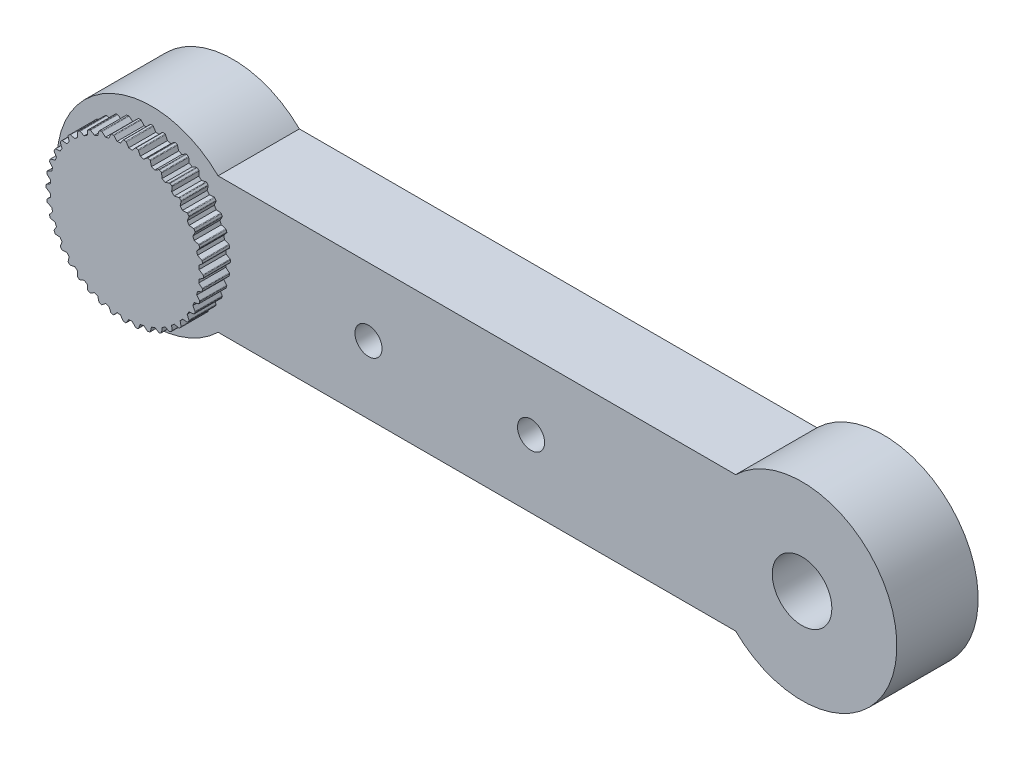
from build123d import *

# Parameters (mm, degrees)
BOSS_EXTRUDE2_DEPTH = 5
BOSS_EXTRUDE3_DEPTH = 15
SKETCH4_R           = 2.5
CUT_EXTRUDE1_DEPTH  = 15
SKETCH5_R           = 5.5
CUT_EXTRUDE2_DEPTH  = 15


with BuildPart() as part:
    # Sketch1 → Boss-Extrude2 (new body)
    with BuildSketch(Plane.XY):
        with BuildLine():
            ThreePointArc((0.302131887, 14.439333637), (0.247751873, 14.490367845), (0.175516255, 14.508906766))
            Line((0.175516255, 14.508906766), (-0.175516255, 14.508906766))
            ThreePointArc((-0.175516255, 14.508906766), (-0.247751873, 14.490367845), (-0.302131887, 14.439333637))
            Line((-0.302131887, 14.439333637), (-0.74, 13.75))
            Line((-0.74, 13.75), (-0.753110668, 13.729359939))
            ThreePointArc((-0.753110668, 13.729359939), (-1.078812566, 13.707613339), (-1.403906451, 13.6781412))
            Line((-1.403906451, 13.6781412), (-1.420084522, 13.696476187))
            Line((-1.420084522, 13.696476187), (-1.960397291, 14.30882532))
            ThreePointArc((-1.960397291, 14.30882532), (-2.022091305, 14.350724303), (-2.09633771, 14.357734839))
            Line((-2.09633771, 14.357734839), (-2.443048426, 14.302821256))
            ThreePointArc((-2.443048426, 14.302821256), (-2.511494579, 14.27321044), (-2.557221575, 14.21429764))
            Line((-2.557221575, 14.21429764), (-2.881863266, 13.464953179))
            Line((-2.881863266, 13.464953179), (-2.891583704, 13.442516271))
            ThreePointArc((-2.891583704, 13.442516271), (-3.209873753, 13.370086405), (-3.526354734, 13.290121229))
            Line((-3.526354734, 13.290121229), (-3.545201851, 13.305699675))
            Line((-3.545201851, 13.305699675), (-4.174654982, 13.825986234))
            ThreePointArc((-4.174654982, 13.825986234), (-4.242143885, 13.857718302), (-4.316572883, 13.853027829))
            Line((-4.316572883, 13.853027829), (-4.650424638, 13.744552818))
            ThreePointArc((-4.650424638, 13.744552818), (-4.713395953, 13.704599223), (-4.749343981, 13.639258459))
            Line((-4.749343981, 13.639258459), (-4.952765495, 12.848354523))
            Line((-4.952765495, 12.848354523), (-4.958856352, 12.824673239))
            ThreePointArc((-4.958856352, 12.824673239), (-5.261897195, 12.703343572), (-5.561972461, 12.574854367))
            Line((-5.561972461, 12.574854367), (-5.583024544, 12.587292677))
            Line((-5.583024544, 12.587292677), (-6.286118812, 13.002705482))
            ThreePointArc((-6.286118812, 13.002705482), (-6.357740804, 13.023489285), (-6.430519705, 13.007213299))
            Line((-6.430519705, 13.007213299), (-6.743291961, 12.847847875))
            ThreePointArc((-6.743291961, 12.847847875), (-6.799237875, 12.798535291), (-6.824521776, 12.72837547))
            Line((-6.824521776, 12.72837547), (-6.901714199, 11.915386738))
            Line((-6.901714199, 11.915386738), (-6.904025499, 11.891044189))
            ThreePointArc((-6.904025499, 11.891044189), (-7.184355265, 11.72380226), (-7.460635966, 11.549952856))
            Line((-7.460635966, 11.549952856), (-7.483374643, 11.558944759))
            Line((-7.483374643, 11.558944759), (-8.242797534, 11.859254967))
            ThreePointArc((-8.242797534, 11.859254967), (-8.316789044, 11.868578739), (-8.386125791, 11.841118009))
            Line((-8.386125791, 11.841118009), (-8.670117057, 11.634786277))
            ThreePointArc((-8.670117057, 11.634786277), (-8.717659996, 11.577328944), (-8.731657196, 11.504077633))
            Line((-8.731657196, 11.504077633), (-8.680719795, 10.689022586))
            Line((-8.680719795, 10.689022586), (-8.679194625, 10.664618168))
            ThreePointArc((-8.679194625, 10.664618168), (-8.929910665, 10.455582027), (-9.175593853, 10.240653175))
            Line((-9.175593853, 10.240653175), (-9.199459223, 10.245977259))
            Line((-9.199459223, 10.245977259), (-9.996511225, 10.423790237))
            ThreePointArc((-9.996511225, 10.423790237), (-10.071050335, 10.421424395), (-10.135237628, 10.383455096))
            Line((-10.135237628, 10.383455096), (-10.383455096, 10.135237628))
            ThreePointArc((-10.383455096, 10.135237628), (-10.421424395, 10.071050335), (-10.423790237, 9.996511225))
            Line((-10.423790237, 9.996511225), (-10.245977259, 9.199459223))
            Line((-10.245977259, 9.199459223), (-10.240653175, 9.175593853))
            ThreePointArc((-10.240653175, 9.175593853), (-10.455582027, 8.929910665), (-10.664618168, 8.679194625))
            Line((-10.664618168, 8.679194625), (-10.689022586, 8.680719795))
            Line((-10.689022586, 8.680719795), (-11.504077633, 8.731657196))
            ThreePointArc((-11.504077633, 8.731657196), (-11.577328944, 8.717659996), (-11.634786277, 8.670117057))
            Line((-11.634786277, 8.670117057), (-11.841118009, 8.386125791))
            ThreePointArc((-11.841118009, 8.386125791), (-11.868578739, 8.316789044), (-11.859254967, 8.242797534))
            Line((-11.859254967, 8.242797534), (-11.558944759, 7.483374643))
            Line((-11.558944759, 7.483374643), (-11.549952856, 7.460635966))
            ThreePointArc((-11.549952856, 7.460635966), (-11.72380226, 7.184355265), (-11.891044189, 6.904025499))
            Line((-11.891044189, 6.904025499), (-11.915386738, 6.901714199))
            Line((-11.915386738, 6.901714199), (-12.72837547, 6.824521776))
            ThreePointArc((-12.72837547, 6.824521776), (-12.798535291, 6.799237875), (-12.847847875, 6.743291961))
            Line((-12.847847875, 6.743291961), (-13.007213299, 6.430519705))
            ThreePointArc((-13.007213299, 6.430519705), (-13.023489285, 6.357740804), (-13.002705482, 6.286118812))
            Line((-13.002705482, 6.286118812), (-12.587292677, 5.583024544))
            Line((-12.587292677, 5.583024544), (-12.574854367, 5.561972461))
            ThreePointArc((-12.574854367, 5.561972461), (-12.703343572, 5.261897195), (-12.824673239, 4.958856352))
            Line((-12.824673239, 4.958856352), (-12.848354523, 4.952765495))
            Line((-12.848354523, 4.952765495), (-13.639258459, 4.749343981))
            ThreePointArc((-13.639258459, 4.749343981), (-13.704599223, 4.713395953), (-13.744552818, 4.650424638))
            Line((-13.744552818, 4.650424638), (-13.853027829, 4.316572883))
            ThreePointArc((-13.853027829, 4.316572883), (-13.857718302, 4.242143885), (-13.825986234, 4.174654982))
            Line((-13.825986234, 4.174654982), (-13.305699675, 3.545201851))
            Line((-13.305699675, 3.545201851), (-13.290121229, 3.526354734))
            ThreePointArc((-13.290121229, 3.526354734), (-13.370086405, 3.209873753), (-13.442516271, 2.891583704))
            Line((-13.442516271, 2.891583704), (-13.464953179, 2.881863266))
            Line((-13.464953179, 2.881863266), (-14.21429764, 2.557221575))
            ThreePointArc((-14.21429764, 2.557221575), (-14.27321044, 2.511494579), (-14.302821256, 2.443048426))
            Line((-14.302821256, 2.443048426), (-14.357734839, 2.09633771))
            ThreePointArc((-14.357734839, 2.09633771), (-14.350724303, 2.022091305), (-14.30882532, 1.960397291))
            Line((-14.30882532, 1.960397291), (-13.696476187, 1.420084522))
            Line((-13.696476187, 1.420084522), (-13.6781412, 1.403906451))
            ThreePointArc((-13.6781412, 1.403906451), (-13.707613339, 1.078812566), (-13.729359939, 0.753110668))
            Line((-13.729359939, 0.753110668), (-13.75, 0.74))
            Line((-13.75, 0.74), (-14.439333637, 0.302131887))
            ThreePointArc((-14.439333637, 0.302131887), (-14.490367845, 0.247751873), (-14.508906766, 0.175516255))
            Line((-14.508906766, 0.175516255), (-14.508906766, -0.175516255))
            ThreePointArc((-14.508906766, -0.175516255), (-14.490367845, -0.247751873), (-14.439333637, -0.302131887))
            Line((-14.439333637, -0.302131887), (-13.75, -0.74))
            Line((-13.75, -0.74), (-13.729359939, -0.753110668))
            ThreePointArc((-13.729359939, -0.753110668), (-13.707613339, -1.078812566), (-13.6781412, -1.403906451))
            Line((-13.6781412, -1.403906451), (-13.696476187, -1.420084522))
            Line((-13.696476187, -1.420084522), (-14.30882532, -1.960397291))
            ThreePointArc((-14.30882532, -1.960397291), (-14.350724303, -2.022091305), (-14.357734839, -2.09633771))
            Line((-14.357734839, -2.09633771), (-14.302821256, -2.443048426))
            ThreePointArc((-14.302821256, -2.443048426), (-14.27321044, -2.511494579), (-14.21429764, -2.557221575))
            Line((-14.21429764, -2.557221575), (-13.464953179, -2.881863266))
            Line((-13.464953179, -2.881863266), (-13.442516271, -2.891583704))
            ThreePointArc((-13.442516271, -2.891583704), (-13.370086405, -3.209873753), (-13.290121229, -3.526354734))
            Line((-13.290121229, -3.526354734), (-13.305699675, -3.545201851))
            Line((-13.305699675, -3.545201851), (-13.825986234, -4.174654982))
            ThreePointArc((-13.825986234, -4.174654982), (-13.857718302, -4.242143885), (-13.853027829, -4.316572883))
            Line((-13.853027829, -4.316572883), (-13.744552818, -4.650424638))
            ThreePointArc((-13.744552818, -4.650424638), (-13.704599223, -4.713395953), (-13.639258459, -4.749343981))
            Line((-13.639258459, -4.749343981), (-12.848354523, -4.952765495))
            Line((-12.848354523, -4.952765495), (-12.824673239, -4.958856352))
            ThreePointArc((-12.824673239, -4.958856352), (-12.703343572, -5.261897195), (-12.574854367, -5.561972461))
            Line((-12.574854367, -5.561972461), (-12.587292677, -5.583024544))
            Line((-12.587292677, -5.583024544), (-13.002705482, -6.286118812))
            ThreePointArc((-13.002705482, -6.286118812), (-13.023489285, -6.357740804), (-13.007213299, -6.430519705))
            Line((-13.007213299, -6.430519705), (-12.847847875, -6.743291961))
            ThreePointArc((-12.847847875, -6.743291961), (-12.798535291, -6.799237875), (-12.72837547, -6.824521776))
            Line((-12.72837547, -6.824521776), (-11.915386738, -6.901714199))
            Line((-11.915386738, -6.901714199), (-11.891044189, -6.904025499))
            ThreePointArc((-11.891044189, -6.904025499), (-11.72380226, -7.184355265), (-11.549952856, -7.460635966))
            Line((-11.549952856, -7.460635966), (-11.558944759, -7.483374643))
            Line((-11.558944759, -7.483374643), (-11.859254967, -8.242797534))
            ThreePointArc((-11.859254967, -8.242797534), (-11.868578739, -8.316789044), (-11.841118009, -8.386125791))
            Line((-11.841118009, -8.386125791), (-11.634786277, -8.670117057))
            ThreePointArc((-11.634786277, -8.670117057), (-11.577328944, -8.717659996), (-11.504077633, -8.731657196))
            Line((-11.504077633, -8.731657196), (-10.689022586, -8.680719795))
            Line((-10.689022586, -8.680719795), (-10.664618168, -8.679194625))
            ThreePointArc((-10.664618168, -8.679194625), (-10.455582027, -8.929910665), (-10.240653175, -9.175593853))
            Line((-10.240653175, -9.175593853), (-10.245977259, -9.199459223))
            Line((-10.245977259, -9.199459223), (-10.423790237, -9.996511225))
            ThreePointArc((-10.423790237, -9.996511225), (-10.421424395, -10.071050335), (-10.383455096, -10.135237628))
            Line((-10.383455096, -10.135237628), (-10.135237628, -10.383455096))
            ThreePointArc((-10.135237628, -10.383455096), (-10.071050335, -10.421424395), (-9.996511225, -10.423790237))
            Line((-9.996511225, -10.423790237), (-9.199459223, -10.245977259))
            Line((-9.199459223, -10.245977259), (-9.175593853, -10.240653175))
            ThreePointArc((-9.175593853, -10.240653175), (-8.929910665, -10.455582027), (-8.679194625, -10.664618168))
            Line((-8.679194625, -10.664618168), (-8.680719795, -10.689022586))
            Line((-8.680719795, -10.689022586), (-8.731657196, -11.504077633))
            ThreePointArc((-8.731657196, -11.504077633), (-8.717659996, -11.577328944), (-8.670117057, -11.634786277))
            Line((-8.670117057, -11.634786277), (-8.386125791, -11.841118009))
            ThreePointArc((-8.386125791, -11.841118009), (-8.316789044, -11.868578739), (-8.242797534, -11.859254967))
            Line((-8.242797534, -11.859254967), (-7.483374643, -11.558944759))
            Line((-7.483374643, -11.558944759), (-7.460635966, -11.549952856))
            ThreePointArc((-7.460635966, -11.549952856), (-7.184355265, -11.72380226), (-6.904025499, -11.891044189))
            Line((-6.904025499, -11.891044189), (-6.901714199, -11.915386738))
            Line((-6.901714199, -11.915386738), (-6.824521776, -12.72837547))
            ThreePointArc((-6.824521776, -12.72837547), (-6.799237875, -12.798535291), (-6.743291961, -12.847847875))
            Line((-6.743291961, -12.847847875), (-6.430519705, -13.007213299))
            ThreePointArc((-6.430519705, -13.007213299), (-6.357740804, -13.023489285), (-6.286118812, -13.002705482))
            Line((-6.286118812, -13.002705482), (-5.583024544, -12.587292677))
            Line((-5.583024544, -12.587292677), (-5.561972461, -12.574854367))
            ThreePointArc((-5.561972461, -12.574854367), (-5.261897195, -12.703343572), (-4.958856352, -12.824673239))
            Line((-4.958856352, -12.824673239), (-4.952765495, -12.848354523))
            Line((-4.952765495, -12.848354523), (-4.749343981, -13.639258459))
            ThreePointArc((-4.749343981, -13.639258459), (-4.713395953, -13.704599223), (-4.650424638, -13.744552818))
            Line((-4.650424638, -13.744552818), (-4.316572883, -13.853027829))
            ThreePointArc((-4.316572883, -13.853027829), (-4.242143885, -13.857718302), (-4.174654982, -13.825986234))
            Line((-4.174654982, -13.825986234), (-3.545201851, -13.305699675))
            Line((-3.545201851, -13.305699675), (-3.526354734, -13.290121229))
            ThreePointArc((-3.526354734, -13.290121229), (-3.209873753, -13.370086405), (-2.891583704, -13.442516271))
            Line((-2.891583704, -13.442516271), (-2.881863266, -13.464953179))
            Line((-2.881863266, -13.464953179), (-2.557221575, -14.21429764))
            ThreePointArc((-2.557221575, -14.21429764), (-2.511494579, -14.27321044), (-2.443048426, -14.302821256))
            Line((-2.443048426, -14.302821256), (-2.09633771, -14.357734839))
            ThreePointArc((-2.09633771, -14.357734839), (-2.022091305, -14.350724303), (-1.960397291, -14.30882532))
            Line((-1.960397291, -14.30882532), (-1.420084522, -13.696476187))
            Line((-1.420084522, -13.696476187), (-1.403906451, -13.6781412))
            ThreePointArc((-1.403906451, -13.6781412), (-1.078812566, -13.707613339), (-0.753110668, -13.729359939))
            Line((-0.753110668, -13.729359939), (-0.74, -13.75))
            Line((-0.74, -13.75), (-0.302131887, -14.439333637))
            ThreePointArc((-0.302131887, -14.439333637), (-0.247751873, -14.490367845), (-0.175516255, -14.508906766))
            Line((-0.175516255, -14.508906766), (0.175516255, -14.508906766))
            ThreePointArc((0.175516255, -14.508906766), (0.247751873, -14.490367845), (0.302131887, -14.439333637))
            Line((0.302131887, -14.439333637), (0.74, -13.75))
            Line((0.74, -13.75), (0.753110668, -13.729359939))
            ThreePointArc((0.753110668, -13.729359939), (1.078812566, -13.707613339), (1.403906451, -13.6781412))
            Line((1.403906451, -13.6781412), (1.420084522, -13.696476187))
            Line((1.420084522, -13.696476187), (1.960397291, -14.30882532))
            ThreePointArc((1.960397291, -14.30882532), (2.022091305, -14.350724303), (2.09633771, -14.357734839))
            Line((2.09633771, -14.357734839), (2.443048426, -14.302821256))
            ThreePointArc((2.443048426, -14.302821256), (2.511494579, -14.27321044), (2.557221575, -14.21429764))
            Line((2.557221575, -14.21429764), (2.881863266, -13.464953179))
            Line((2.881863266, -13.464953179), (2.891583704, -13.442516271))
            ThreePointArc((2.891583704, -13.442516271), (3.209873753, -13.370086405), (3.526354734, -13.290121229))
            Line((3.526354734, -13.290121229), (3.545201851, -13.305699675))
            Line((3.545201851, -13.305699675), (4.174654982, -13.825986234))
            ThreePointArc((4.174654982, -13.825986234), (4.242143885, -13.857718302), (4.316572883, -13.853027829))
            Line((4.316572883, -13.853027829), (4.650424638, -13.744552818))
            ThreePointArc((4.650424638, -13.744552818), (4.713395953, -13.704599223), (4.749343981, -13.639258459))
            Line((4.749343981, -13.639258459), (4.952765495, -12.848354523))
            Line((4.952765495, -12.848354523), (4.958856352, -12.824673239))
            ThreePointArc((4.958856352, -12.824673239), (5.261897195, -12.703343572), (5.561972461, -12.574854367))
            Line((5.561972461, -12.574854367), (5.583024544, -12.587292677))
            Line((5.583024544, -12.587292677), (6.286118812, -13.002705482))
            ThreePointArc((6.286118812, -13.002705482), (6.357740804, -13.023489285), (6.430519705, -13.007213299))
            Line((6.430519705, -13.007213299), (6.743291961, -12.847847875))
            ThreePointArc((6.743291961, -12.847847875), (6.799237875, -12.798535291), (6.824521776, -12.72837547))
            Line((6.824521776, -12.72837547), (6.901714199, -11.915386738))
            Line((6.901714199, -11.915386738), (6.904025499, -11.891044189))
            ThreePointArc((6.904025499, -11.891044189), (7.184355265, -11.72380226), (7.460635966, -11.549952856))
            Line((7.460635966, -11.549952856), (7.483374643, -11.558944759))
            Line((7.483374643, -11.558944759), (8.242797534, -11.859254967))
            ThreePointArc((8.242797534, -11.859254967), (8.316789044, -11.868578739), (8.386125791, -11.841118009))
            Line((8.386125791, -11.841118009), (8.670117057, -11.634786277))
            ThreePointArc((8.670117057, -11.634786277), (8.717659996, -11.577328944), (8.731657196, -11.504077633))
            Line((8.731657196, -11.504077633), (8.680719795, -10.689022586))
            Line((8.680719795, -10.689022586), (8.679194625, -10.664618168))
            ThreePointArc((8.679194625, -10.664618168), (8.929910665, -10.455582027), (9.175593853, -10.240653175))
            Line((9.175593853, -10.240653175), (9.199459223, -10.245977259))
            Line((9.199459223, -10.245977259), (9.996511225, -10.423790237))
            ThreePointArc((9.996511225, -10.423790237), (10.071050335, -10.421424395), (10.135237628, -10.383455096))
            Line((10.135237628, -10.383455096), (10.383455096, -10.135237628))
            ThreePointArc((10.383455096, -10.135237628), (10.421424395, -10.071050335), (10.423790237, -9.996511225))
            Line((10.423790237, -9.996511225), (10.245977259, -9.199459223))
            Line((10.245977259, -9.199459223), (10.240653175, -9.175593853))
            ThreePointArc((10.240653175, -9.175593853), (10.455582027, -8.929910665), (10.664618168, -8.679194625))
            Line((10.664618168, -8.679194625), (10.689022586, -8.680719795))
            Line((10.689022586, -8.680719795), (11.504077633, -8.731657196))
            ThreePointArc((11.504077633, -8.731657196), (11.577328944, -8.717659996), (11.634786277, -8.670117057))
            Line((11.634786277, -8.670117057), (11.841118009, -8.386125791))
            ThreePointArc((11.841118009, -8.386125791), (11.868578739, -8.316789044), (11.859254967, -8.242797534))
            Line((11.859254967, -8.242797534), (11.558944759, -7.483374643))
            Line((11.558944759, -7.483374643), (11.549952856, -7.460635966))
            ThreePointArc((11.549952856, -7.460635966), (11.72380226, -7.184355265), (11.891044189, -6.904025499))
            Line((11.891044189, -6.904025499), (11.915386738, -6.901714199))
            Line((11.915386738, -6.901714199), (12.72837547, -6.824521776))
            ThreePointArc((12.72837547, -6.824521776), (12.798535291, -6.799237875), (12.847847875, -6.743291961))
            Line((12.847847875, -6.743291961), (13.007213299, -6.430519705))
            ThreePointArc((13.007213299, -6.430519705), (13.023489285, -6.357740804), (13.002705482, -6.286118812))
            Line((13.002705482, -6.286118812), (12.587292677, -5.583024544))
            Line((12.587292677, -5.583024544), (12.574854367, -5.561972461))
            ThreePointArc((12.574854367, -5.561972461), (12.703343572, -5.261897195), (12.824673239, -4.958856352))
            Line((12.824673239, -4.958856352), (12.848354523, -4.952765495))
            Line((12.848354523, -4.952765495), (13.639258459, -4.749343981))
            ThreePointArc((13.639258459, -4.749343981), (13.704599223, -4.713395953), (13.744552818, -4.650424638))
            Line((13.744552818, -4.650424638), (13.853027829, -4.316572883))
            ThreePointArc((13.853027829, -4.316572883), (13.857718302, -4.242143885), (13.825986234, -4.174654982))
            Line((13.825986234, -4.174654982), (13.305699675, -3.545201851))
            Line((13.305699675, -3.545201851), (13.290121229, -3.526354734))
            ThreePointArc((13.290121229, -3.526354734), (13.370086405, -3.209873753), (13.442516271, -2.891583704))
            Line((13.442516271, -2.891583704), (13.464953179, -2.881863266))
            Line((13.464953179, -2.881863266), (14.21429764, -2.557221575))
            ThreePointArc((14.21429764, -2.557221575), (14.27321044, -2.511494579), (14.302821256, -2.443048426))
            Line((14.302821256, -2.443048426), (14.357734839, -2.09633771))
            ThreePointArc((14.357734839, -2.09633771), (14.350724303, -2.022091305), (14.30882532, -1.960397291))
            Line((14.30882532, -1.960397291), (13.696476187, -1.420084522))
            Line((13.696476187, -1.420084522), (13.6781412, -1.403906451))
            ThreePointArc((13.6781412, -1.403906451), (13.707613339, -1.078812566), (13.729359939, -0.753110668))
            Line((13.729359939, -0.753110668), (13.75, -0.74))
            Line((13.75, -0.74), (14.439333637, -0.302131887))
            ThreePointArc((14.439333637, -0.302131887), (14.490367845, -0.247751873), (14.508906766, -0.175516255))
            Line((14.508906766, -0.175516255), (14.508906766, 0.175516255))
            ThreePointArc((14.508906766, 0.175516255), (14.490367845, 0.247751873), (14.439333637, 0.302131887))
            Line((14.439333637, 0.302131887), (13.75, 0.74))
            Line((13.75, 0.74), (13.729359939, 0.753110668))
            ThreePointArc((13.729359939, 0.753110668), (13.707613339, 1.078812566), (13.6781412, 1.403906451))
            Line((13.6781412, 1.403906451), (13.696476187, 1.420084522))
            Line((13.696476187, 1.420084522), (14.30882532, 1.960397291))
            ThreePointArc((14.30882532, 1.960397291), (14.350724303, 2.022091305), (14.357734839, 2.09633771))
            Line((14.357734839, 2.09633771), (14.302821256, 2.443048426))
            ThreePointArc((14.302821256, 2.443048426), (14.27321044, 2.511494579), (14.21429764, 2.557221575))
            Line((14.21429764, 2.557221575), (13.464953179, 2.881863266))
            Line((13.464953179, 2.881863266), (13.442516271, 2.891583704))
            ThreePointArc((13.442516271, 2.891583704), (13.370086405, 3.209873753), (13.290121229, 3.526354734))
            Line((13.290121229, 3.526354734), (13.305699675, 3.545201851))
            Line((13.305699675, 3.545201851), (13.825986234, 4.174654982))
            ThreePointArc((13.825986234, 4.174654982), (13.857718302, 4.242143885), (13.853027829, 4.316572883))
            Line((13.853027829, 4.316572883), (13.744552818, 4.650424638))
            ThreePointArc((13.744552818, 4.650424638), (13.704599223, 4.713395953), (13.639258459, 4.749343981))
            Line((13.639258459, 4.749343981), (12.848354523, 4.952765495))
            Line((12.848354523, 4.952765495), (12.824673239, 4.958856352))
            ThreePointArc((12.824673239, 4.958856352), (12.703343572, 5.261897195), (12.574854367, 5.561972461))
            Line((12.574854367, 5.561972461), (12.587292677, 5.583024544))
            Line((12.587292677, 5.583024544), (13.002705482, 6.286118812))
            ThreePointArc((13.002705482, 6.286118812), (13.023489285, 6.357740804), (13.007213299, 6.430519705))
            Line((13.007213299, 6.430519705), (12.847847875, 6.743291961))
            ThreePointArc((12.847847875, 6.743291961), (12.798535291, 6.799237875), (12.72837547, 6.824521776))
            Line((12.72837547, 6.824521776), (11.915386738, 6.901714199))
            Line((11.915386738, 6.901714199), (11.891044189, 6.904025499))
            ThreePointArc((11.891044189, 6.904025499), (11.72380226, 7.184355265), (11.549952856, 7.460635966))
            Line((11.549952856, 7.460635966), (11.558944759, 7.483374643))
            Line((11.558944759, 7.483374643), (11.859254967, 8.242797534))
            ThreePointArc((11.859254967, 8.242797534), (11.868578739, 8.316789044), (11.841118009, 8.386125791))
            Line((11.841118009, 8.386125791), (11.634786277, 8.670117057))
            ThreePointArc((11.634786277, 8.670117057), (11.577328944, 8.717659996), (11.504077633, 8.731657196))
            Line((11.504077633, 8.731657196), (10.689022586, 8.680719795))
            Line((10.689022586, 8.680719795), (10.664618168, 8.679194625))
            ThreePointArc((10.664618168, 8.679194625), (10.455582027, 8.929910665), (10.240653175, 9.175593853))
            Line((10.240653175, 9.175593853), (10.245977259, 9.199459223))
            Line((10.245977259, 9.199459223), (10.423790237, 9.996511225))
            ThreePointArc((10.423790237, 9.996511225), (10.421424395, 10.071050335), (10.383455096, 10.135237628))
            Line((10.383455096, 10.135237628), (10.135237628, 10.383455096))
            ThreePointArc((10.135237628, 10.383455096), (10.071050335, 10.421424395), (9.996511225, 10.423790237))
            Line((9.996511225, 10.423790237), (9.199459223, 10.245977259))
            Line((9.199459223, 10.245977259), (9.175593853, 10.240653175))
            ThreePointArc((9.175593853, 10.240653175), (8.929910665, 10.455582027), (8.679194625, 10.664618168))
            Line((8.679194625, 10.664618168), (8.680719795, 10.689022586))
            Line((8.680719795, 10.689022586), (8.731657196, 11.504077633))
            ThreePointArc((8.731657196, 11.504077633), (8.717659996, 11.577328944), (8.670117057, 11.634786277))
            Line((8.670117057, 11.634786277), (8.386125791, 11.841118009))
            ThreePointArc((8.386125791, 11.841118009), (8.316789044, 11.868578739), (8.242797534, 11.859254967))
            Line((8.242797534, 11.859254967), (7.483374643, 11.558944759))
            Line((7.483374643, 11.558944759), (7.460635966, 11.549952856))
            ThreePointArc((7.460635966, 11.549952856), (7.184355265, 11.72380226), (6.904025499, 11.891044189))
            Line((6.904025499, 11.891044189), (6.901714199, 11.915386738))
            Line((6.901714199, 11.915386738), (6.824521776, 12.72837547))
            ThreePointArc((6.824521776, 12.72837547), (6.799237875, 12.798535291), (6.743291961, 12.847847875))
            Line((6.743291961, 12.847847875), (6.430519705, 13.007213299))
            ThreePointArc((6.430519705, 13.007213299), (6.357740804, 13.023489285), (6.286118812, 13.002705482))
            Line((6.286118812, 13.002705482), (5.583024544, 12.587292677))
            Line((5.583024544, 12.587292677), (5.561972461, 12.574854367))
            ThreePointArc((5.561972461, 12.574854367), (5.261897195, 12.703343572), (4.958856352, 12.824673239))
            Line((4.958856352, 12.824673239), (4.952765495, 12.848354523))
            Line((4.952765495, 12.848354523), (4.749343981, 13.639258459))
            ThreePointArc((4.749343981, 13.639258459), (4.713395953, 13.704599223), (4.650424638, 13.744552818))
            Line((4.650424638, 13.744552818), (4.316572883, 13.853027829))
            ThreePointArc((4.316572883, 13.853027829), (4.242143885, 13.857718302), (4.174654982, 13.825986234))
            Line((4.174654982, 13.825986234), (3.545201851, 13.305699675))
            Line((3.545201851, 13.305699675), (3.526354734, 13.290121229))
            ThreePointArc((3.526354734, 13.290121229), (3.209873753, 13.370086405), (2.891583704, 13.442516271))
            Line((2.891583704, 13.442516271), (2.881863266, 13.464953179))
            Line((2.881863266, 13.464953179), (2.557221575, 14.21429764))
            ThreePointArc((2.557221575, 14.21429764), (2.511494579, 14.27321044), (2.443048426, 14.302821256))
            Line((2.443048426, 14.302821256), (2.09633771, 14.357734839))
            ThreePointArc((2.09633771, 14.357734839), (2.022091305, 14.350724303), (1.960397291, 14.30882532))
            Line((1.960397291, 14.30882532), (1.420084522, 13.696476187))
            Line((1.420084522, 13.696476187), (1.403906451, 13.6781412))
            ThreePointArc((1.403906451, 13.6781412), (1.078812566, 13.707613339), (0.753110668, 13.729359939))
            Line((0.753110668, 13.729359939), (0.74, 13.75))
            Line((0.74, 13.75), (0.302131887, 14.439333637))
        make_face()
    extrude(amount=BOSS_EXTRUDE2_DEPTH)

    # Sketch2 → Boss-Extrude3 (add)
    with BuildSketch(Plane(origin=(0, 0, 0), x_dir=(-1, 0, 0), z_dir=(0, 0, -1))):
        with BuildLine():
            ThreePointArc((-107.752551286, 12.5), (-137.5, 0), (-107.752551286, -12.5))
            Line((-107.752551286, -12.5), (-120, -12.5))
            Line((-120, -12.5), (-120, 12.5))
            Line((-120, 12.5), (-107.752551286, 12.5))
        make_face()
        with BuildLine():
            Line((-120, -12.5), (-107.752551286, -12.5))
            ThreePointArc((-107.752551286, -12.5), (-103.866489029, -6.779367504), (-102.5, 0))
            ThreePointArc((-102.5, 0), (-103.866489029, 6.779367504), (-107.752551286, 12.5))
            Line((-107.752551286, 12.5), (-120, 12.5))
            Line((-120, 12.5), (-120, -12.5))
        make_face()
        with BuildLine():
            Line((-107.752551286, -12.5), (-12.247448714, -12.5))
            ThreePointArc((-12.247448714, -12.5), (-17.5, 0), (-12.247448714, 12.5))
            Line((-12.247448714, 12.5), (-107.752551286, 12.5))
            ThreePointArc((-107.752551286, 12.5), (-103.866489029, 6.779367504), (-102.5, 0))
            ThreePointArc((-102.5, 0), (-103.866489029, -6.779367504), (-107.752551286, -12.5))
        make_face()
        with BuildLine():
            Line((0, 12.5), (0, -12.5))
            Line((0, -12.5), (-12.247448714, -12.5))
            ThreePointArc((-12.247448714, -12.5), (6.779367504, -16.133510971), (17.5, 0))
            ThreePointArc((17.5, 0), (6.779367504, 16.133510971), (-12.247448714, 12.5))
            Line((-12.247448714, 12.5), (0, 12.5))
        make_face()
        with BuildLine():
            Line((-12.247448714, -12.5), (0, -12.5))
            Line((0, -12.5), (0, 12.5))
            Line((0, 12.5), (-12.247448714, 12.5))
            ThreePointArc((-12.247448714, 12.5), (-17.5, 0), (-12.247448714, -12.5))
        make_face()
    extrude(amount=BOSS_EXTRUDE3_DEPTH)

    # Sketch4 → Cut-Extrude1 (cut)
    with BuildSketch(Plane.XY):
        with Locations((40, 0)):
            Circle(SKETCH4_R)
        with Locations((70, 0)):
            Circle(SKETCH4_R)
    extrude(amount=-CUT_EXTRUDE1_DEPTH, mode=Mode.SUBTRACT)

    # Sketch5 → Cut-Extrude2 (cut)
    with BuildSketch(Plane.XY):
        with Locations((120, 0)):
            Circle(SKETCH5_R)
    extrude(amount=-CUT_EXTRUDE2_DEPTH, mode=Mode.SUBTRACT)


solid = part.part
